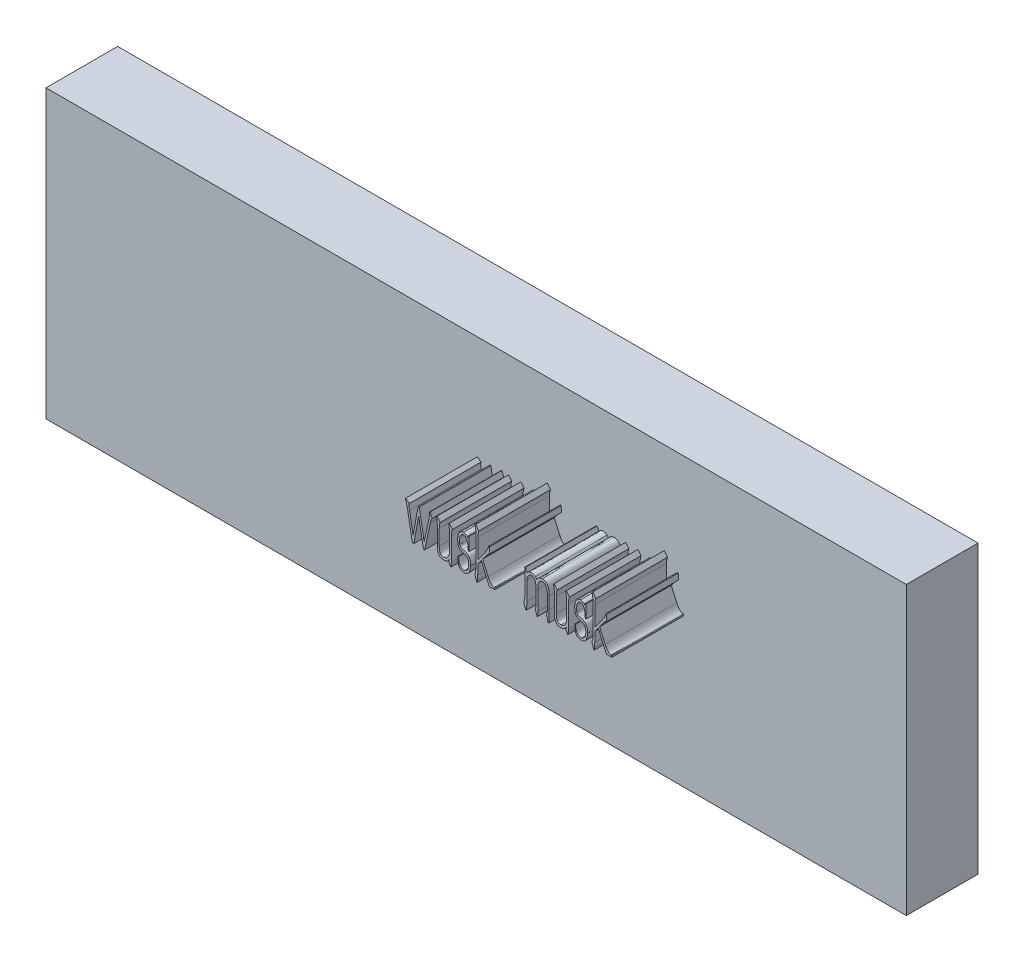
from build123d import *

# Parameters (mm, degrees)
SKETCH_1_W      = 60
SKETCH_1_H      = 20
EXTRUDE_1_DEPTH = 5
EXTRUDE_2_DEPTH = 5


with BuildPart() as part:
    # 草图1 → 凸台-拉伸1 (new body)
    with BuildSketch(Plane.XY):
        Rectangle(SKETCH_1_W, SKETCH_1_H)
    extrude(amount=EXTRUDE_1_DEPTH)

    # 草图2 → 凸台-拉伸2 (add)
    with BuildSketch(Plane.XY.offset(5)):
        with BuildLine():
            Line((0.956850629, 2.693053484), (1.032175581, 2.693053484))
            Line((1.032175581, 2.693053484), (1.374493927, 0.765182186))
            Line((1.374493927, 0.765182186), (1.686234818, 2.215001065))
            add(Edge.make_bspline(
                [(1.686234818, 2.215001065), (1.694034814, 2.25098296), (1.708511764, 2.317766087), (1.723755254, 2.411736454), (1.735575995, 2.491496907), (1.740113853, 2.540393283), (1.742169188, 2.562539953)],
                knots=[0, 0, 0, 0, 1.25398068, 2.327413638, 3.242434274, 4, 4, 4, 4], degree=3))
            Line((1.742169188, 2.562539953), (1.742169188, 2.672917111))
            Line((1.742169188, 2.672917111), (1.746643938, 2.753462604))
            Line((1.746643938, 2.753462604), (1.792137226, 2.778819518))
            Line((1.792137226, 2.778819518), (1.923396548, 2.441721713))
            add(Edge.make_bspline(
                [(1.923396548, 2.441721713), (1.915438067, 2.430541224), (1.900004303, 2.408859068), (1.875735262, 2.374566878), (1.852698706, 2.328662005), (1.833798101, 2.268497129), (1.814819577, 2.20170425), (1.806483591, 2.155909649), (1.802578308, 2.134455572)],
                knots=[0, 0, 0, 0, 0.73960617, 1.434307217, 2.260967932, 3.493612538, 4.825795476, 6, 6, 6, 6], degree=3))
            Line((1.802578308, 2.134455572), (1.414766674, 0.296825059))
            Line((1.414766674, 0.296825059), (1.323780098, 0.296825059))
            Line((1.323780098, 0.296825059), (0.991902834, 2.134455572))
            Line((0.991902834, 2.134455572), (0.654805029, 0.296825059))
            Line((0.654805029, 0.296825059), (0.548902621, 0.296825059))
            Line((0.548902621, 0.296825059), (0.206584274, 2.215001065))
            add(Edge.make_bspline(
                [(0.206584274, 2.215001065), (0.198912438, 2.248321954), (0.184597239, 2.310496781), (0.163982743, 2.39769166), (0.147074131, 2.474104096), (0.127415601, 2.53928743), (0.108679799, 2.59454942), (0.096507892, 2.627939378), (0.090986576, 2.643085446)],
                knots=[0, 0, 0, 0, 1.386558097, 2.587236253, 3.633788418, 4.558844335, 5.346275232, 6, 6, 6, 6], degree=3))
            Line((0.090986576, 2.643085446), (0.065629661, 2.708715108))
            Line((0.065629661, 2.708715108), (0.090986576, 2.763903686))
            Line((0.090986576, 2.763903686), (0.332623056, 2.557319412))
            add(Edge.make_bspline(
                [(0.332623056, 2.557319412), (0.329934305, 2.539424397), (0.325272047, 2.508394672), (0.317905436, 2.463306249), (0.318744441, 2.41459229), (0.318124787, 2.366339195), (0.321879478, 2.317770287), (0.328324646, 2.274328176), (0.336178515, 2.225964508), (0.343632909, 2.192344597), (0.347538888, 2.174728319)],
                knots=[0, 0, 0, 0, 1.125948555, 1.952380253, 2.833667599, 4.147756758, 4.953989267, 5.859088633, 6.878197816, 8, 8, 8, 8], degree=3))
            Line((0.347538888, 2.174728319), (0.6040912, 0.755486895))
            Line((0.6040912, 0.755486895), (0.956850629, 2.693053484))
        make_face()
        with BuildLine():
            Line((3.079373535, 2.718410398), (3.124866823, 2.763903686))
            Line((3.124866823, 2.763903686), (3.341146388, 2.491689751))
            add(Edge.make_bspline(
                [(3.341146388, 2.491689751), (3.335127204, 2.476880592), (3.324424362, 2.450548104), (3.31474904, 2.416817894), (3.308260388, 2.38888809), (3.303313096, 2.360726643), (3.297436787, 2.323631469), (3.287042616, 2.26229054), (3.277646408, 2.177974894), (3.276230477, 2.108877444), (3.275516727, 2.074046452)],
                knots=[0, 0, 0, 0, 0.901954883, 1.603785607, 1.978329198, 2.520694973, 3.217595566, 4.099112837, 6.033621101, 8, 8, 8, 8], degree=3))
            Line((3.275516727, 2.074046452), (3.271041977, 0.493714042))
            Line((3.271041977, 0.493714042), (3.260600895, 0.296825059))
            add(Edge.make_bspline(
                [(3.260600895, 0.296825059), (3.260015138, 0.285378319), (3.258943854, 0.26444349), (3.255309304, 0.236175576), (3.253833678, 0.213986302), (3.250040675, 0.194151459), (3.244934554, 0.17817626), (3.236749598, 0.161933992), (3.223030618, 0.163741996), (3.214049918, 0.174993267), (3.202853577, 0.192573139), (3.195091054, 0.207465128), (3.190496484, 0.216279565)],
                knots=[0, 0, 0, 0, 1.638485852, 2.996610579, 4.068241337, 4.828079896, 5.839672715, 6.62244258, 6.979652832, 7.608485938, 8.584483878, 10, 10, 10, 10], degree=3))
            Line((3.190496484, 0.216279565), (3.11442574, 0.36245472))
            add(Edge.make_bspline(
                [(3.11442574, 0.36245472), (3.109237472, 0.371568592), (3.100128905, 0.387568982), (3.090889622, 0.409378255), (3.083820187, 0.425199719), (3.084377975, 0.434266836), (3.084594076, 0.437779672)],
                knots=[0, 0, 0, 0, 1.529770544, 2.685677999, 3.490797633, 4, 4, 4, 4], degree=3))
            Line((3.084594076, 0.437779672), (3.109950991, 0.48327296))
            Line((3.109950991, 0.48327296), (3.130087364, 0.589175368))
            add(Edge.make_bspline(
                [(3.130087364, 0.589175368), (3.119854153, 0.569911613), (3.100234155, 0.532977479), (3.072949231, 0.488659865), (3.047364841, 0.45513354), (3.019093926, 0.433646228), (2.986817641, 0.409964319), (2.947190812, 0.388763769), (2.901968138, 0.36995589), (2.850348815, 0.356380862), (2.792925865, 0.349534962), (2.752732548, 0.348221699), (2.731834647, 0.347538888)],
                knots=[0, 0, 0, 0, 1.312029654, 2.515536564, 3.132302309, 3.833292519, 4.638429977, 5.542167297, 6.528311998, 7.580541878, 8.742039772, 10, 10, 10, 10], degree=3))
            add(Edge.make_bspline(
                [(2.731834647, 0.347538888), (2.707934865, 0.347387207), (2.662386327, 0.347098133), (2.597539313, 0.35683285), (2.5398564, 0.374410494), (2.489918618, 0.401083366), (2.446817948, 0.434389683), (2.409884203, 0.473872061), (2.378367288, 0.518768429), (2.344936868, 0.586220761), (2.315366494, 0.677701691), (2.301170715, 0.775927949), (2.298391463, 0.862372578), (2.295980876, 0.939931821), (2.294598456, 1.029685469), (2.294243946, 1.093578814), (2.294054975, 1.127636906)],
                knots=[0, 0, 0, 0, 0.968661519, 1.846088638, 2.650099344, 3.403737013, 4.130145597, 4.850928472, 5.589769445, 6.347715959, 7.898125862, 9.468914246, 10.35757796, 11.407170027, 12.617902367, 14, 14, 14, 14], degree=3))
            Line((2.294054975, 1.127636906), (2.294054975, 2.174728319))
            add(Edge.make_bspline(
                [(2.294054975, 2.174728319), (2.2939419, 2.208798516), (2.29372463, 2.274263098), (2.287271989, 2.368528418), (2.27865126, 2.454615867), (2.267422657, 2.53033631), (2.25704408, 2.592127762), (2.251044664, 2.628169047), (2.248561688, 2.643085446)],
                knots=[0, 0, 0, 0, 1.300902488, 2.499634388, 3.606888644, 4.604547608, 5.422464392, 6, 6, 6, 6], degree=3))
            Line((2.248561688, 2.643085446), (2.223950565, 2.718410398))
            Line((2.223950565, 2.718410398), (2.268698061, 2.763903686))
            Line((2.268698061, 2.763903686), (2.490198167, 2.491689751))
            add(Edge.make_bspline(
                [(2.490198167, 2.491689751), (2.484051601, 2.476346533), (2.472759124, 2.448157963), (2.458516081, 2.404686971), (2.447527054, 2.354443766), (2.437925695, 2.303747214), (2.431424871, 2.251652424), (2.427841576, 2.202624281), (2.425677835, 2.14615934), (2.425440336, 2.105869066), (2.425314298, 2.084487535)],
                knots=[0, 0, 0, 0, 0.955062306, 1.754641118, 2.639723451, 3.924612311, 4.735340528, 5.671856169, 6.764483984, 8, 8, 8, 8], degree=3))
            Line((2.425314298, 2.084487535), (2.425314298, 1.026955039))
            add(Edge.make_bspline(
                [(2.425314298, 1.026955039), (2.425487673, 0.993114723), (2.425813361, 0.929545126), (2.434754228, 0.840997868), (2.445183114, 0.764966918), (2.46342138, 0.701977268), (2.485737836, 0.649699395), (2.513309582, 0.607543044), (2.545468208, 0.573925518), (2.582622337, 0.549892534), (2.623819398, 0.533834923), (2.667892564, 0.526692502), (2.714509574, 0.522607318), (2.746020732, 0.526658774), (2.762412103, 0.528766248)],
                knots=[0, 0, 0, 0, 1.7189745, 3.229122124, 4.521318276, 5.613109994, 6.552296241, 7.4004455, 8.159999876, 8.899528822, 9.631679654, 10.390076894, 11.16255546, 12, 12, 12, 12], degree=3))
            add(Edge.make_bspline(
                [(2.762412103, 0.528766248), (2.78816119, 0.532312476), (2.83576389, 0.53886844), (2.899642093, 0.557600142), (2.951569652, 0.580406604), (3.000998795, 0.622014292), (3.045701732, 0.684265281), (3.087916707, 0.763317502), (3.118941538, 0.842713306), (3.133904088, 0.909087919), (3.139397427, 0.96325686), (3.143505782, 1.010718505), (3.144335519, 1.066482619), (3.144769802, 1.106259678), (3.145003196, 1.127636906)],
                knots=[0, 0, 0, 0, 1.171183412, 2.165183308, 2.998184278, 3.707820518, 5.051940327, 6.427255088, 7.748233698, 8.886001551, 9.484403013, 10.204602517, 11.035106635, 12, 12, 12, 12], degree=3))
            Line((3.145003196, 1.127636906), (3.145003196, 2.094182825))
            add(Edge.make_bspline(
                [(3.145003196, 2.094182825), (3.144850716, 2.137695071), (3.144547347, 2.224265433), (3.139150891, 2.33040375), (3.133991537, 2.409660124), (3.130851677, 2.459218735), (3.125975495, 2.498914141), (3.121128073, 2.539807389), (3.113213532, 2.587019898), (3.10423607, 2.62374933), (3.099509908, 2.643085446)],
                knots=[0, 0, 0, 0, 1.89138301, 3.763026071, 4.618502937, 5.344598615, 5.921038749, 6.356690794, 7.134884036, 8, 8, 8, 8], degree=3))
            Line((3.099509908, 2.643085446), (3.079373535, 2.718410398))
        make_face()
        with BuildLine():
            Line((4.42030684, 2.522267206), (4.465800128, 2.66322182))
            Line((4.465800128, 2.66322182), (4.500852333, 2.658001278))
            Line((4.500852333, 2.658001278), (4.500852333, 1.736948647))
            Line((4.500852333, 1.736948647), (4.456104837, 1.736948647))
            add(Edge.make_bspline(
                [(4.456104837, 1.736948647), (4.452625812, 1.78667141), (4.445996573, 1.88141751), (4.436354459, 2.018869804), (4.421625179, 2.149812964), (4.395009218, 2.254181503), (4.368520463, 2.334352191), (4.341804871, 2.387599138), (4.311833094, 2.435317015), (4.275661738, 2.474416059), (4.238118302, 2.506759772), (4.199222339, 2.530385766), (4.159051225, 2.545040791), (4.131800177, 2.546766667), (4.11826124, 2.547624121)],
                knots=[0, 0, 0, 0, 1.88437823, 3.590658997, 5.211116296, 6.856969368, 7.653605172, 8.397603321, 9.104084967, 9.776155038, 10.403139336, 10.972141148, 11.489336478, 12, 12, 12, 12], degree=3))
            add(Edge.make_bspline(
                [(4.11826124, 2.547624121), (4.100646596, 2.546064854), (4.066378892, 2.543031442), (4.019049055, 2.522888982), (3.976681941, 2.494562309), (3.93239471, 2.441415007), (3.889579043, 2.367309418), (3.858948103, 2.269609155), (3.843234994, 2.166710361), (3.834517409, 2.077485446), (3.83148966, 2.003876017), (3.835824724, 1.950568202), (3.842376001, 1.899849842), (3.851843314, 1.868116229), (3.856488387, 1.852546346)],
                knots=[0, 0, 0, 0, 0.763111865, 1.484565427, 2.206018988, 2.955268939, 4.4638776, 5.893852316, 7.371769709, 8.976120531, 9.785810629, 10.56470826, 11.295783766, 12, 12, 12, 12], degree=3))
            add(Edge.make_bspline(
                [(3.856488387, 1.852546346), (3.859766633, 1.838228755), (3.865988508, 1.811054994), (3.881782399, 1.774634166), (3.897387095, 1.742373396), (3.918325534, 1.716030702), (3.943810996, 1.694934312), (3.973561301, 1.676585851), (4.008857992, 1.661860762), (4.03463778, 1.654855964), (4.048156829, 1.651182612)],
                knots=[0, 0, 0, 0, 1.181279318, 2.241983418, 3.192228972, 4.062377461, 4.929751825, 5.847528273, 6.871233056, 8, 8, 8, 8], degree=3))
            Line((4.048156829, 1.651182612), (4.198806733, 1.616130407))
            add(Edge.make_bspline(
                [(4.198806733, 1.616130407), (4.232301465, 1.605241264), (4.2962154, 1.584462833), (4.382284615, 1.537683246), (4.456679096, 1.481057201), (4.504127195, 1.419480231), (4.535552443, 1.364044564), (4.557632442, 1.316604569), (4.575559154, 1.262864891), (4.597980677, 1.183269576), (4.616787913, 1.073775128), (4.617056478, 0.983535306), (4.617195824, 0.936714255)],
                knots=[0, 0, 0, 0, 1.209249621, 2.307464452, 3.354609308, 4.401754164, 4.953353382, 5.546482869, 6.198302843, 6.899633981, 8.39137101, 10, 10, 10, 10], degree=3))
            add(Edge.make_bspline(
                [(4.617195824, 0.936714255), (4.61266176, 0.888061495), (4.60385957, 0.793609617), (4.576723044, 0.68051691), (4.550491712, 0.598297277), (4.529936637, 0.544202137), (4.50678806, 0.497110111), (4.474884718, 0.444372071), (4.428676791, 0.389187156), (4.372369626, 0.347625724), (4.322473492, 0.32277661), (4.279782474, 0.311805808), (4.233497903, 0.302671932), (4.200849959, 0.302259723), (4.183890901, 0.3020456)],
                knots=[0, 0, 0, 0, 2.057181033, 3.993701746, 4.884987729, 5.694367223, 6.430000302, 7.093039265, 8.289669114, 9.435885792, 10.016959139, 10.627150019, 11.286869617, 12, 12, 12, 12], degree=3))
            add(Edge.make_bspline(
                [(4.183890901, 0.3020456), (4.166716962, 0.301584906), (4.132748421, 0.300673695), (4.083075215, 0.307295287), (4.035081084, 0.317317929), (3.977215303, 0.338767014), (3.914594792, 0.372213181), (3.851865097, 0.422031547), (3.808086423, 0.486815326), (3.776396943, 0.56248449), (3.753095282, 0.647578419), (3.73462749, 0.736733625), (3.723230778, 0.825302718), (3.721556397, 0.883485792), (3.720754315, 0.911357341)],
                knots=[0, 0, 0, 0, 0.705919631, 1.396246844, 2.056504843, 2.719925773, 3.928363854, 4.96712199, 5.980428126, 7.107526555, 8.331541373, 9.605625387, 10.853018187, 12, 12, 12, 12], degree=3))
            Line((3.720754315, 0.911357341), (3.715533774, 1.057532495))
            Line((3.715533774, 1.057532495), (3.761027062, 1.057532495))
            add(Edge.make_bspline(
                [(3.761027062, 1.057532495), (3.761560295, 1.033664123), (3.762561496, 0.988848759), (3.767401415, 0.922142153), (3.780462949, 0.852834813), (3.797360407, 0.774480074), (3.827433012, 0.689048051), (3.864179958, 0.618781617), (3.902538495, 0.56673039), (3.937047923, 0.532423684), (3.976308513, 0.502753967), (4.020041475, 0.479590488), (4.065183061, 0.461320882), (4.110875561, 0.452164927), (4.155378814, 0.447057534), (4.184405018, 0.451324291), (4.198806733, 0.453441296)],
                knots=[0, 0, 0, 0, 1.180171397, 2.215895155, 3.300676226, 4.66281128, 6.174567634, 7.763264609, 8.561949105, 9.36129496, 10.159979456, 10.984704713, 11.801612493, 12.555966091, 13.283524481, 14, 14, 14, 14], degree=3))
            add(Edge.make_bspline(
                [(4.198806733, 0.453441296), (4.212571098, 0.455525007), (4.23902737, 0.459530077), (4.276117577, 0.47186835), (4.30956885, 0.487951458), (4.338740899, 0.510710077), (4.365490086, 0.539045119), (4.389679717, 0.574707955), (4.413686148, 0.616811394), (4.436228452, 0.665146799), (4.456472994, 0.718273751), (4.471307473, 0.77475025), (4.480253735, 0.83351122), (4.483392488, 0.892671603), (4.48374868, 0.949143998), (4.483749197, 1.000103485), (4.483508711, 1.043653946), (4.481581406, 1.070216045), (4.48071596, 1.082143618)],
                knots=[0, 0, 0, 0, 0.877851347, 1.68730455, 2.459813735, 3.21046647, 4.01026565, 4.912088624, 5.924932797, 7.069995579, 8.277531082, 9.51162898, 10.750911348, 12.025314486, 13.250286763, 14.318123558, 15.244762084, 16, 16, 16, 16], degree=3))
            add(Edge.make_bspline(
                [(4.48071596, 1.082143618), (4.47378711, 1.112218546), (4.460681063, 1.169105826), (4.430419633, 1.245666982), (4.397216015, 1.310362912), (4.352090855, 1.357723705), (4.301218467, 1.39300016), (4.241442607, 1.419417522), (4.170067771, 1.441995512), (4.087026354, 1.459911254), (4.000805208, 1.482511845), (3.931959894, 1.509072439), (3.883763917, 1.53933113), (3.851513054, 1.568429651), (3.821279352, 1.602949654), (3.794860249, 1.644064819), (3.771665535, 1.690259807), (3.753415312, 1.741245278), (3.738217828, 1.796306022), (3.724082805, 1.874663759), (3.714308334, 1.972866439), (3.712117153, 2.051155995), (3.711059024, 2.088962284)],
                knots=[0, 0, 0, 0, 1.312732654, 2.483057945, 3.5025627, 4.386828712, 5.238919358, 6.125149634, 7.160161885, 8.424087566, 9.742278237, 10.957883032, 11.548460543, 12.15626294, 12.801923705, 13.498163234, 14.232361306, 14.99973133, 15.801420386, 16.663524038, 18.388804572, 20, 20, 20, 20], degree=3))
            add(Edge.make_bspline(
                [(3.711059024, 2.088962284), (3.711355759, 2.110842662), (3.711929664, 2.153160804), (3.71601027, 2.214259605), (3.724650715, 2.27041662), (3.737982362, 2.33919296), (3.764714725, 2.419199492), (3.803604285, 2.509872653), (3.85583499, 2.5910804), (3.913767978, 2.645522379), (3.966929253, 2.678767517), (4.012248998, 2.696051638), (4.061596491, 2.706544999), (4.096082441, 2.707978957), (4.113786491, 2.708715108)],
                knots=[0, 0, 0, 0, 0.958068417, 1.852969566, 2.678027658, 3.444349453, 4.917639168, 6.359843754, 7.757537576, 9.112888036, 9.801703641, 10.490949085, 11.225298654, 12, 12, 12, 12], degree=3))
            add(Edge.make_bspline(
                [(4.113786491, 2.708715108), (4.14273878, 2.705391618), (4.199550832, 2.698870053), (4.274747565, 2.666437031), (4.336035892, 2.629585778), (4.363705153, 2.596745786), (4.375559344, 2.582676326)],
                knots=[0, 0, 0, 0, 1.164144761, 2.284360071, 3.264977708, 4, 4, 4, 4], degree=3))
            Line((4.375559344, 2.582676326), (4.42030684, 2.522267206))
        make_face()
        with BuildLine():
            Line((5.120605157, 1.545280205), (5.644150863, 2.275410185))
            add(Edge.make_bspline(
                [(5.644150863, 2.275410185), (5.659979366, 2.298916394), (5.693192215, 2.348239324), (5.732385734, 2.412426537), (5.761544973, 2.465441369), (5.782526817, 2.50102598), (5.797752347, 2.532990737), (5.814419556, 2.569989981), (5.831347575, 2.616226308), (5.844096192, 2.653504296), (5.850735137, 2.672917111)],
                knots=[0, 0, 0, 0, 1.511957053, 3.172529951, 4.009937113, 4.740410216, 5.375135452, 5.897668644, 6.905193875, 8, 8, 8, 8], degree=3))
            Line((5.850735137, 2.672917111), (5.87534626, 2.748987854))
            Line((5.87534626, 2.748987854), (5.931280631, 2.738546772))
            Line((5.931280631, 2.738546772), (5.940975922, 2.315682932))
            add(Edge.make_bspline(
                [(5.940975922, 2.315682932), (5.928764133, 2.309536186), (5.906611986, 2.298386007), (5.87424806, 2.280874178), (5.841656418, 2.256950723), (5.811595242, 2.23008432), (5.782423786, 2.200187586), (5.756593354, 2.168902301), (5.72563226, 2.13205137), (5.705129311, 2.104017123), (5.6941189, 2.088962284)],
                knots=[0, 0, 0, 0, 0.96646153, 1.753158176, 2.596659124, 3.816416994, 4.599180132, 5.546284665, 6.682315694, 8, 8, 8, 8], degree=3))
            Line((5.6941189, 2.088962284), (5.448007671, 1.75708502))
            Line((5.448007671, 1.75708502), (5.835073514, 0.891220967))
            add(Edge.make_bspline(
                [(5.835073514, 0.891220967), (5.846413565, 0.864956913), (5.867982707, 0.815001839), (5.903816322, 0.746735881), (5.938903125, 0.687773526), (5.984183624, 0.623699368), (6.043748217, 0.559410529), (6.10465073, 0.505036693), (6.153233121, 0.473694998), (6.184075669, 0.455174881), (6.212066582, 0.443485892), (6.229785038, 0.439557088), (6.23780098, 0.437779672)],
                knots=[0, 0, 0, 0, 1.370886093, 2.607469256, 3.692673887, 4.658220336, 6.362432645, 7.883761008, 8.554703716, 9.131156491, 9.606929679, 10, 10, 10, 10], degree=3))
            Line((6.23780098, 0.437779672), (6.2982101, 0.428084381))
            Line((6.2982101, 0.428084381), (6.303430641, 0.332623056))
            Line((6.303430641, 0.332623056), (5.920839548, 0.332623056))
            Line((5.920839548, 0.332623056), (5.357021095, 1.631046239))
            Line((5.357021095, 1.631046239), (5.120605157, 1.308864266))
            Line((5.120605157, 1.308864266), (5.110164074, 0.634668655))
            Line((5.110164074, 0.634668655), (5.100468783, 0.322181973))
            add(Edge.make_bspline(
                [(5.100468783, 0.322181973), (5.100338427, 0.297996517), (5.100106249, 0.254919939), (5.093034428, 0.205682651), (5.085750467, 0.175360061), (5.080617463, 0.162409845), (5.073581035, 0.152620593), (5.068042312, 0.154825275), (5.065416578, 0.155870445)],
                knots=[0, 0, 0, 0, 2.406597193, 4.286376539, 4.978070304, 5.466542587, 5.747104715, 6, 6, 6, 6], degree=3))
            add(Edge.make_bspline(
                [(5.065416578, 0.155870445), (5.063111719, 0.156479495), (5.057011805, 0.158091371), (5.047209479, 0.167481866), (5.036298692, 0.18586932), (5.029370319, 0.201978064), (5.025143831, 0.211804816)],
                knots=[0, 0, 0, 0, 0.397271662, 1.051397412, 2.201276048, 4, 4, 4, 4], degree=3))
            Line((5.025143831, 0.211804816), (5.005007458, 0.276688685))
            Line((5.005007458, 0.276688685), (4.944598338, 0.453441296))
            add(Edge.make_bspline(
                [(4.944598338, 0.453441296), (4.939245299, 0.46930492), (4.929842289, 0.497170555), (4.919117246, 0.534287309), (4.912827653, 0.560802846), (4.909547266, 0.585272811), (4.918936454, 0.612842137), (4.930783605, 0.647217559), (4.945768606, 0.680802366), (4.95781678, 0.714189246), (4.966923798, 0.754590752), (4.972629819, 0.808351386), (4.978269, 0.869773514), (4.981521006, 0.923019706), (4.983801369, 0.969509352), (4.984057089, 1.016019423), (4.985149383, 1.075178663), (4.984969668, 1.118686465), (4.984871085, 1.142552738)],
                knots=[0, 0, 0, 0, 1.142457736, 2.0068119, 2.632308866, 3.006993311, 3.669348092, 4.57068696, 5.506168794, 6.171340735, 6.990057557, 8.323856883, 9.856380766, 11.198994077, 11.963000091, 13.031688272, 14.371727881, 16, 16, 16, 16], degree=3))
            Line((4.984871085, 1.142552738), (4.984871085, 2.990624334))
            add(Edge.make_bspline(
                [(4.984871085, 2.990624334), (4.985033993, 3.013497467), (4.985340374, 3.05651504), (4.983350701, 3.116662151), (4.982245957, 3.168395952), (4.979191731, 3.225367398), (4.974138264, 3.289519827), (4.962196077, 3.361159795), (4.950264589, 3.427150064), (4.942845645, 3.469171147), (4.939377797, 3.488813126)],
                knots=[0, 0, 0, 0, 1.094712718, 2.05882963, 2.880208996, 3.571276556, 4.78969525, 5.957622138, 7.045328208, 8, 8, 8, 8], degree=3))
            Line((4.939377797, 3.488813126), (4.919241423, 3.569358619))
            Line((4.919241423, 3.569358619), (4.964734711, 3.614851907))
            Line((4.964734711, 3.614851907), (5.186234818, 3.322501598))
            add(Edge.make_bspline(
                [(5.186234818, 3.322501598), (5.180103379, 3.305655623), (5.168914397, 3.274914172), (5.1552073, 3.229900909), (5.145306441, 3.184370219), (5.135969396, 3.142291217), (5.130086578, 3.098152891), (5.127641435, 3.051561741), (5.12635766, 2.992373173), (5.126014127, 2.94886122), (5.125825698, 2.924994673)],
                knots=[0, 0, 0, 0, 1.062325433, 1.938589134, 2.785507672, 3.822714499, 4.491512402, 5.421484825, 6.585670171, 8, 8, 8, 8], degree=3))
            Line((5.125825698, 2.924994673), (5.120605157, 1.545280205))
        make_face()
        with BuildLine():
            add(Edge.make_bspline(
                [(9.234391647, 2.416364799), (9.252239678, 2.43874551), (9.286320294, 2.481481227), (9.34045576, 2.539359634), (9.397707997, 2.588477031), (9.463392945, 2.624442965), (9.536886033, 2.65040827), (9.589657371, 2.655410888), (9.61698274, 2.658001278)],
                knots=[0, 0, 0, 0, 1.097159194, 2.095013154, 3.035933001, 3.974677868, 4.951273982, 6, 6, 6, 6], degree=3))
            add(Edge.make_bspline(
                [(9.61698274, 2.658001278), (9.646190311, 2.657067172), (9.703064386, 2.655248244), (9.771865653, 2.638117875), (9.82381142, 2.618414994), (9.861105793, 2.597474706), (9.896470538, 2.570060946), (9.940889995, 2.526221022), (9.989855053, 2.461536156), (10.023290186, 2.385751579), (10.043778195, 2.319638156), (10.057143304, 2.264317228), (10.068045623, 2.203743794), (10.080832532, 2.116619115), (10.092480509, 2.003987558), (10.094183282, 1.912988075), (10.095035159, 1.867462178)],
                knots=[0, 0, 0, 0, 1.166996922, 2.272420106, 2.817555006, 3.387814551, 3.976949789, 4.603236808, 5.882949516, 7.196532102, 7.895238063, 8.653091083, 9.472834461, 10.3580348, 12.177970592, 14, 14, 14, 14], degree=3))
            Line((10.095035159, 1.867462178), (10.095035159, 1.012039207))
            add(Edge.make_bspline(
                [(10.095035159, 1.012039207), (10.095152747, 0.983698163), (10.095401349, 0.923780285), (10.093301616, 0.829074492), (10.092171056, 0.724654824), (10.089982943, 0.615772853), (10.087224943, 0.512369912), (10.087231028, 0.424353465), (10.085596391, 0.356487479), (10.086841819, 0.306519352), (10.087268756, 0.270203939), (10.085614397, 0.243058642), (10.080836326, 0.222941743), (10.071698324, 0.206639943), (10.059276909, 0.197800554), (10.043316198, 0.191064255), (10.031735659, 0.206072569), (10.024024281, 0.222372493), (10.017323958, 0.246739571), (10.008131125, 0.276033959), (9.997187668, 0.31601176), (9.988668856, 0.345814032), (9.98391221, 0.36245472)],
                knots=[0, 0, 0, 0, 1.668545598, 3.527594419, 5.576894584, 7.816688853, 9.939415945, 11.66656902, 12.998558643, 13.935400335, 14.60867312, 15.137408637, 15.531504822, 15.820179061, 16.206590182, 16.447979296, 16.706923024, 17.16511372, 17.563265891, 18.174498434, 18.980695134, 20, 20, 20, 20], degree=3))
            Line((9.98391221, 0.36245472), (9.933944172, 0.523545706))
            add(Edge.make_bspline(
                [(9.933944172, 0.523545706), (9.930409206, 0.53372277), (9.923982576, 0.552224851), (9.916057957, 0.57734447), (9.912337225, 0.597798956), (9.913370523, 0.609556615), (9.913807799, 0.614532282)],
                knots=[0, 0, 0, 0, 1.374458822, 2.49879042, 3.364710346, 4, 4, 4, 4], degree=3))
            Line((9.913807799, 0.614532282), (9.933944172, 0.654805029))
            add(Edge.make_bspline(
                [(9.933944172, 0.654805029), (9.934158417, 0.657543577), (9.934726621, 0.664806542), (9.937240608, 0.678763852), (9.94193434, 0.698247224), (9.947108148, 0.72436393), (9.9535529, 0.75701239), (9.957344958, 0.797211517), (9.96123852, 0.844435687), (9.962890035, 0.878285781), (9.963775836, 0.896441509)],
                knots=[0, 0, 0, 0, 0.270200862, 0.716605739, 1.393214368, 2.242395503, 3.336406814, 4.665529256, 6.211534079, 8, 8, 8, 8], degree=3))
            Line((9.963775836, 0.896441509), (9.968996378, 1.842851055))
            add(Edge.make_bspline(
                [(9.968996378, 1.842851055), (9.968801603, 1.852796523), (9.968348419, 1.875936707), (9.966062075, 1.915752789), (9.961074467, 1.965141129), (9.955012284, 2.04143481), (9.943046857, 2.135201282), (9.927481665, 2.22477937), (9.907402741, 2.289393252), (9.884000572, 2.3343204), (9.851819348, 2.376867294), (9.814089929, 2.417597856), (9.769428673, 2.452200024), (9.717661967, 2.475360274), (9.660618758, 2.486048481), (9.621479189, 2.483372613), (9.601321117, 2.48199446)],
                knots=[0, 0, 0, 0, 0.497531525, 1.157609791, 1.994048707, 2.980215242, 4.98520248, 6.721483315, 7.519710007, 8.359469601, 9.239856946, 10.181018871, 11.131010515, 12.043817659, 12.992506382, 14, 14, 14, 14], degree=3))
            add(Edge.make_bspline(
                [(9.601321117, 2.48199446), (9.584497103, 2.479130356), (9.551560791, 2.473523311), (9.506032478, 2.454885066), (9.46444882, 2.431233067), (9.419215079, 2.388980191), (9.372569239, 2.330160732), (9.339497069, 2.270231624), (9.326562864, 2.22374374), (9.321092412, 2.192002204), (9.315859287, 2.152699365), (9.311342436, 2.105697243), (9.308763896, 2.050696035), (9.306489112, 1.988046712), (9.305042471, 1.917933345), (9.304684216, 1.868705758), (9.304496058, 1.842851055)],
                knots=[0, 0, 0, 0, 0.915149417, 1.791584769, 2.630823118, 3.473568715, 5.100176098, 6.660825913, 7.105271245, 7.690054186, 8.391574603, 9.237707285, 10.228544875, 11.352355912, 12.609437143, 14, 14, 14, 14], degree=3))
            Line((9.304496058, 1.842851055), (9.304496058, 0.523545706))
            add(Edge.make_bspline(
                [(9.304496058, 0.523545706), (9.304568585, 0.5049004), (9.304706877, 0.469348189), (9.303784744, 0.419134181), (9.303, 0.374635411), (9.30249735, 0.33634112), (9.301103955, 0.303741224), (9.298756282, 0.277180488), (9.296689892, 0.256215746), (9.293886438, 0.237667047), (9.290578711, 0.220635257), (9.285718473, 0.208793097), (9.280973959, 0.198257046), (9.276534667, 0.200442853), (9.274664394, 0.201363733)],
                knots=[0, 0, 0, 0, 2.018694608, 3.84917562, 5.437443463, 6.837330508, 7.995966644, 8.968298726, 9.726258143, 10.270599101, 11.015056889, 11.534889805, 11.804049086, 12, 12, 12, 12], degree=3))
            add(Edge.make_bspline(
                [(9.274664394, 0.201363733), (9.272389634, 0.202021996), (9.265792167, 0.20393115), (9.255769258, 0.21123101), (9.245425515, 0.222949761), (9.23875018, 0.236883632), (9.235830135, 0.252270045), (9.229896681, 0.2689853), (9.222621562, 0.291075462), (9.217229445, 0.307759106), (9.214255274, 0.316961432)],
                knots=[0, 0, 0, 0, 0.416697809, 1.208545478, 2.142378398, 3.16402006, 3.888430023, 4.902489823, 6.29148252, 8, 8, 8, 8], degree=3))
            Line((9.214255274, 0.316961432), (9.153846154, 0.488493501))
            add(Edge.make_bspline(
                [(9.153846154, 0.488493501), (9.148106429, 0.504384458), (9.138096436, 0.532098047), (9.125398253, 0.568200749), (9.119049015, 0.593264691), (9.116662005, 0.613883722), (9.125950797, 0.632082918), (9.133458141, 0.656668138), (9.145698119, 0.687439184), (9.155556888, 0.720017574), (9.162018511, 0.754340262), (9.166560656, 0.789162708), (9.168351861, 0.832286506), (9.168616919, 0.863627102), (9.168761986, 0.880779885)],
                knots=[0, 0, 0, 0, 1.502686716, 2.620662923, 3.3924411, 3.812845123, 4.420784842, 5.147603737, 6.112263195, 7.356718112, 8.167070135, 9.214007623, 10.475219694, 12, 12, 12, 12], degree=3))
            Line((9.168761986, 0.880779885), (9.173982527, 1.842851055))
            add(Edge.make_bspline(
                [(9.173982527, 1.842851055), (9.17374433, 1.853540389), (9.173206877, 1.877659111), (9.172042855, 1.917988303), (9.167603133, 1.966642977), (9.163639631, 2.021618997), (9.158776044, 2.0778464), (9.152909875, 2.130081906), (9.146206407, 2.17586658), (9.136596292, 2.228389268), (9.119391583, 2.289473349), (9.081730209, 2.35405143), (9.033379679, 2.412667502), (8.969570364, 2.449273285), (8.909083499, 2.475297858), (8.86913283, 2.479968248), (8.851800554, 2.48199446)],
                knots=[0, 0, 0, 0, 0.564606381, 1.273941307, 2.129706037, 3.143536047, 4.184618774, 5.109478364, 5.918883535, 6.626881124, 7.930739658, 9.241452327, 10.552887859, 11.885891606, 13.082811067, 14, 14, 14, 14], degree=3))
            add(Edge.make_bspline(
                [(8.851800554, 2.48199446), (8.843537297, 2.480484302), (8.825898442, 2.477260699), (8.798102146, 2.46674022), (8.767610711, 2.451122069), (8.724046409, 2.424882851), (8.673725162, 2.387760572), (8.622195999, 2.334973967), (8.585403105, 2.268838538), (8.559630783, 2.192194221), (8.543655507, 2.110221341), (8.540717928, 2.054964115), (8.539313872, 2.028553164)],
                knots=[0, 0, 0, 0, 0.421476153, 0.899688394, 1.486375, 2.142042782, 3.453913914, 4.620616388, 5.81854381, 7.221271278, 8.671868436, 10, 10, 10, 10], degree=3))
            Line((8.539313872, 2.028553164), (8.53409333, 0.755486895))
            add(Edge.make_bspline(
                [(8.53409333, 0.755486895), (8.534260432, 0.72863648), (8.534573005, 0.67841097), (8.5325605, 0.608318151), (8.531514318, 0.548632472), (8.52836559, 0.484485166), (8.524323915, 0.415093525), (8.517481835, 0.341966069), (8.511581343, 0.282835763), (8.507246176, 0.239178239), (8.503784869, 0.212388414), (8.499900852, 0.193360016), (8.485252277, 0.189339232), (8.477961934, 0.193627174), (8.473684211, 0.196143192)],
                knots=[0, 0, 0, 0, 1.64190357, 3.071291216, 4.287896094, 5.292317629, 6.998354817, 8.539922834, 9.777341985, 10.648689864, 11.186190396, 11.49960437, 11.706384953, 12, 12, 12, 12], degree=3))
            add(Edge.make_bspline(
                [(8.473684211, 0.196143192), (8.467351876, 0.199303748), (8.453593325, 0.206170833), (8.444303194, 0.233589282), (8.434544631, 0.270323365), (8.424487207, 0.299550034), (8.418495632, 0.316961432)],
                knots=[0, 0, 0, 0, 0.599074229, 1.301635721, 2.392485552, 4, 4, 4, 4], degree=3))
            Line((8.418495632, 0.316961432), (8.358086512, 0.488493501))
            add(Edge.make_bspline(
                [(8.358086512, 0.488493501), (8.35297789, 0.503612471), (8.343813824, 0.530733532), (8.333523437, 0.566885913), (8.326886425, 0.593350199), (8.323827084, 0.618324823), (8.332949605, 0.646929653), (8.344923343, 0.682068974), (8.359915622, 0.715876907), (8.369987902, 0.7429414), (8.375303534, 0.765528378), (8.378636961, 0.789244306), (8.382449035, 0.82106317), (8.386869412, 0.871318569), (8.391485159, 0.931802403), (8.397709585, 0.989113812), (8.401043588, 1.033631468), (8.40207306, 1.073940845), (8.404073864, 1.123146361), (8.403753366, 1.15895725), (8.4035798, 1.178350735)],
                knots=[0, 0, 0, 0, 1.224001232, 2.195666149, 2.880219036, 3.320413069, 4.102156795, 5.133358169, 6.184981354, 6.932735303, 7.34433354, 7.961878087, 8.768343447, 9.802361354, 11.830726809, 13.420615288, 14.223466219, 15.253785847, 16.512780229, 18, 18, 18, 18], degree=3))
            Line((8.4035798, 1.178350735), (8.408800341, 2.229916898))
            add(Edge.make_bspline(
                [(8.408800341, 2.229916898), (8.408966176, 2.259998891), (8.409277313, 2.316438396), (8.407266126, 2.395232916), (8.406227762, 2.46262417), (8.404407459, 2.503624896), (8.4035798, 2.522267206)],
                knots=[0, 0, 0, 0, 1.234375642, 2.315921974, 3.234279288, 4, 4, 4, 4], degree=3))
            Line((8.4035798, 2.522267206), (8.393138717, 2.637864905))
            Line((8.393138717, 2.637864905), (8.383443426, 2.738546772))
            Line((8.383443426, 2.738546772), (8.428936714, 2.748987854))
            Line((8.428936714, 2.748987854), (8.559450245, 2.491689751))
            add(Edge.make_bspline(
                [(8.559450245, 2.491689751), (8.574095851, 2.50613437), (8.602390323, 2.534040547), (8.644143349, 2.57444544), (8.687638926, 2.610708982), (8.738385111, 2.636694954), (8.795163759, 2.654031759), (8.859506991, 2.656705336), (8.931488377, 2.648026335), (8.995018039, 2.629917556), (9.047016929, 2.611724481), (9.081696756, 2.593748535), (9.110937577, 2.572828629), (9.126266528, 2.55586239), (9.133709781, 2.547624121)],
                knots=[0, 0, 0, 0, 1.128901386, 2.180972772, 3.19106158, 4.222490723, 5.288974718, 6.423551697, 7.728474675, 9.254322165, 10.040057965, 10.748014846, 11.392075655, 12, 12, 12, 12], degree=3))
            Line((9.133709781, 2.547624121), (9.234391647, 2.416364799))
        make_face()
        with BuildLine():
            Line((11.241316855, 2.718410398), (11.286810143, 2.763903686))
            Line((11.286810143, 2.763903686), (11.503089708, 2.491689751))
            add(Edge.make_bspline(
                [(11.503089708, 2.491689751), (11.497070524, 2.476880592), (11.486367682, 2.450548104), (11.47669236, 2.416817894), (11.470203707, 2.38888809), (11.465256416, 2.360726643), (11.459380107, 2.323631469), (11.448985936, 2.26229054), (11.439589728, 2.177974894), (11.438173797, 2.108877444), (11.437460047, 2.074046452)],
                knots=[0, 0, 0, 0, 0.901954883, 1.603785607, 1.978329198, 2.520694973, 3.217595566, 4.099112837, 6.033621101, 8, 8, 8, 8], degree=3))
            Line((11.437460047, 2.074046452), (11.432985297, 0.493714042))
            Line((11.432985297, 0.493714042), (11.422544215, 0.296825059))
            add(Edge.make_bspline(
                [(11.422544215, 0.296825059), (11.421958458, 0.285378319), (11.420887174, 0.26444349), (11.417252624, 0.236175576), (11.415776998, 0.213986302), (11.411983994, 0.194151459), (11.406877874, 0.17817626), (11.398692918, 0.161933992), (11.384973937, 0.163741996), (11.375993237, 0.174993267), (11.364796897, 0.192573139), (11.357034373, 0.207465128), (11.352439804, 0.216279565)],
                knots=[0, 0, 0, 0, 1.638485852, 2.996610579, 4.068241337, 4.828079896, 5.839672715, 6.62244258, 6.979652832, 7.608485938, 8.584483878, 10, 10, 10, 10], degree=3))
            Line((11.352439804, 0.216279565), (11.27636906, 0.36245472))
            add(Edge.make_bspline(
                [(11.27636906, 0.36245472), (11.271180792, 0.371568592), (11.262072225, 0.387568982), (11.252832942, 0.409378255), (11.245763506, 0.425199719), (11.246321295, 0.434266836), (11.246537396, 0.437779672)],
                knots=[0, 0, 0, 0, 1.529770544, 2.685677999, 3.490797633, 4, 4, 4, 4], degree=3))
            Line((11.246537396, 0.437779672), (11.271894311, 0.48327296))
            Line((11.271894311, 0.48327296), (11.292030684, 0.589175368))
            add(Edge.make_bspline(
                [(11.292030684, 0.589175368), (11.281797472, 0.569911613), (11.262177475, 0.532977479), (11.234892551, 0.488659865), (11.209308161, 0.45513354), (11.181037245, 0.433646228), (11.148760961, 0.409964319), (11.109134132, 0.388763769), (11.063911458, 0.36995589), (11.012292135, 0.356380862), (10.954869185, 0.349534962), (10.914675867, 0.348221699), (10.893777967, 0.347538888)],
                knots=[0, 0, 0, 0, 1.312029654, 2.515536564, 3.132302309, 3.833292519, 4.638429977, 5.542167297, 6.528311998, 7.580541878, 8.742039772, 10, 10, 10, 10], degree=3))
            add(Edge.make_bspline(
                [(10.893777967, 0.347538888), (10.869878185, 0.347387207), (10.824329647, 0.347098133), (10.759482633, 0.35683285), (10.70179972, 0.374410494), (10.651861938, 0.401083366), (10.608761268, 0.434389683), (10.571827523, 0.473872061), (10.540310608, 0.518768429), (10.506880188, 0.586220761), (10.477309814, 0.677701691), (10.463114035, 0.775927949), (10.460334783, 0.862372578), (10.457924196, 0.939931821), (10.456541776, 1.029685469), (10.456187266, 1.093578814), (10.455998295, 1.127636906)],
                knots=[0, 0, 0, 0, 0.968661519, 1.846088638, 2.650099344, 3.403737013, 4.130145597, 4.850928472, 5.589769445, 6.347715959, 7.898125862, 9.468914246, 10.35757796, 11.407170027, 12.617902367, 14, 14, 14, 14], degree=3))
            Line((10.455998295, 1.127636906), (10.455998295, 2.174728319))
            add(Edge.make_bspline(
                [(10.455998295, 2.174728319), (10.45588522, 2.208798516), (10.45566795, 2.274263098), (10.449215308, 2.368528418), (10.440594579, 2.454615867), (10.429365976, 2.53033631), (10.418987399, 2.592127762), (10.412987984, 2.628169047), (10.410505007, 2.643085446)],
                knots=[0, 0, 0, 0, 1.300902488, 2.499634388, 3.606888644, 4.604547608, 5.422464392, 6, 6, 6, 6], degree=3))
            Line((10.410505007, 2.643085446), (10.385893885, 2.718410398))
            Line((10.385893885, 2.718410398), (10.430641381, 2.763903686))
            Line((10.430641381, 2.763903686), (10.652141487, 2.491689751))
            add(Edge.make_bspline(
                [(10.652141487, 2.491689751), (10.645994921, 2.476346533), (10.634702444, 2.448157963), (10.620459401, 2.404686971), (10.609470374, 2.354443766), (10.599869015, 2.303747214), (10.593368191, 2.251652424), (10.589784896, 2.202624281), (10.587621155, 2.14615934), (10.587383656, 2.105869066), (10.587257618, 2.084487535)],
                knots=[0, 0, 0, 0, 0.955062306, 1.754641118, 2.639723451, 3.924612311, 4.735340528, 5.671856169, 6.764483984, 8, 8, 8, 8], degree=3))
            Line((10.587257618, 2.084487535), (10.587257618, 1.026955039))
            add(Edge.make_bspline(
                [(10.587257618, 1.026955039), (10.587430993, 0.993114723), (10.587756681, 0.929545126), (10.596697547, 0.840997868), (10.607126434, 0.764966918), (10.6253647, 0.701977268), (10.647681155, 0.649699395), (10.675252902, 0.607543044), (10.707411527, 0.573925518), (10.744565657, 0.549892534), (10.785762718, 0.533834923), (10.829835884, 0.526692502), (10.876452894, 0.522607318), (10.907964052, 0.526658774), (10.924355423, 0.528766248)],
                knots=[0, 0, 0, 0, 1.7189745, 3.229122124, 4.521318276, 5.613109994, 6.552296241, 7.4004455, 8.159999876, 8.899528822, 9.631679654, 10.390076894, 11.16255546, 12, 12, 12, 12], degree=3))
            add(Edge.make_bspline(
                [(10.924355423, 0.528766248), (10.95010451, 0.532312476), (10.99770721, 0.53886844), (11.061585413, 0.557600142), (11.113512972, 0.580406604), (11.162942115, 0.622014292), (11.207645052, 0.684265281), (11.249860026, 0.763317502), (11.280884858, 0.842713306), (11.295847408, 0.909087919), (11.301340747, 0.96325686), (11.305449102, 1.010718505), (11.306278839, 1.066482619), (11.306713121, 1.106259678), (11.306946516, 1.127636906)],
                knots=[0, 0, 0, 0, 1.171183412, 2.165183308, 2.998184278, 3.707820518, 5.051940327, 6.427255088, 7.748233698, 8.886001551, 9.484403013, 10.204602517, 11.035106635, 12, 12, 12, 12], degree=3))
            Line((11.306946516, 1.127636906), (11.306946516, 2.094182825))
            add(Edge.make_bspline(
                [(11.306946516, 2.094182825), (11.306794036, 2.137695071), (11.306490667, 2.224265433), (11.301094211, 2.33040375), (11.295934856, 2.409660124), (11.292794997, 2.459218735), (11.287918814, 2.498914141), (11.283071393, 2.539807389), (11.275156852, 2.587019898), (11.26617939, 2.62374933), (11.261453228, 2.643085446)],
                knots=[0, 0, 0, 0, 1.89138301, 3.763026071, 4.618502937, 5.344598615, 5.921038749, 6.356690794, 7.134884036, 8, 8, 8, 8], degree=3))
            Line((11.261453228, 2.643085446), (11.241316855, 2.718410398))
        make_face()
        with BuildLine():
            Line((12.58225016, 2.522267206), (12.627743448, 2.66322182))
            Line((12.627743448, 2.66322182), (12.662795653, 2.658001278))
            Line((12.662795653, 2.658001278), (12.662795653, 1.736948647))
            Line((12.662795653, 1.736948647), (12.618048157, 1.736948647))
            add(Edge.make_bspline(
                [(12.618048157, 1.736948647), (12.614569131, 1.78667141), (12.607939892, 1.88141751), (12.598297779, 2.018869804), (12.583568499, 2.149812964), (12.556952538, 2.254181503), (12.530463782, 2.334352191), (12.503748191, 2.387599138), (12.473776414, 2.435317015), (12.437605058, 2.474416059), (12.400061622, 2.506759772), (12.361165659, 2.530385766), (12.320994545, 2.545040791), (12.293743497, 2.546766667), (12.28020456, 2.547624121)],
                knots=[0, 0, 0, 0, 1.88437823, 3.590658997, 5.211116296, 6.856969368, 7.653605172, 8.397603321, 9.104084967, 9.776155038, 10.403139336, 10.972141148, 11.489336478, 12, 12, 12, 12], degree=3))
            add(Edge.make_bspline(
                [(12.28020456, 2.547624121), (12.262589916, 2.546064854), (12.228322212, 2.543031442), (12.180992374, 2.522888982), (12.138625261, 2.494562309), (12.09433803, 2.441415007), (12.051522363, 2.367309418), (12.020891422, 2.269609155), (12.005178314, 2.166710361), (11.996460729, 2.077485446), (11.99343298, 2.003876017), (11.997768044, 1.950568202), (12.00431932, 1.899849842), (12.013786633, 1.868116229), (12.018431707, 1.852546346)],
                knots=[0, 0, 0, 0, 0.763111865, 1.484565427, 2.206018988, 2.955268939, 4.4638776, 5.893852316, 7.371769709, 8.976120531, 9.785810629, 10.56470826, 11.295783766, 12, 12, 12, 12], degree=3))
            add(Edge.make_bspline(
                [(12.018431707, 1.852546346), (12.021709952, 1.838228755), (12.027931828, 1.811054994), (12.043725719, 1.774634166), (12.059330415, 1.742373396), (12.080268854, 1.716030702), (12.105754316, 1.694934312), (12.13550462, 1.676585851), (12.170801312, 1.661860762), (12.196581099, 1.654855964), (12.210100149, 1.651182612)],
                knots=[0, 0, 0, 0, 1.181279318, 2.241983418, 3.192228972, 4.062377461, 4.929751825, 5.847528273, 6.871233056, 8, 8, 8, 8], degree=3))
            Line((12.210100149, 1.651182612), (12.360750053, 1.616130407))
            add(Edge.make_bspline(
                [(12.360750053, 1.616130407), (12.394244784, 1.605241264), (12.458158719, 1.584462833), (12.544227935, 1.537683246), (12.618622416, 1.481057201), (12.666070515, 1.419480231), (12.697495763, 1.364044564), (12.719575762, 1.316604569), (12.737502474, 1.262864891), (12.759923997, 1.183269576), (12.778731233, 1.073775128), (12.778999798, 0.983535306), (12.779139143, 0.936714255)],
                knots=[0, 0, 0, 0, 1.209249621, 2.307464452, 3.354609308, 4.401754164, 4.953353382, 5.546482869, 6.198302843, 6.899633981, 8.39137101, 10, 10, 10, 10], degree=3))
            add(Edge.make_bspline(
                [(12.779139143, 0.936714255), (12.77460508, 0.888061495), (12.76580289, 0.793609617), (12.738666364, 0.68051691), (12.712435032, 0.598297277), (12.691879956, 0.544202137), (12.66873138, 0.497110111), (12.636828037, 0.444372071), (12.590620111, 0.389187156), (12.534312946, 0.347625724), (12.484416812, 0.32277661), (12.441725794, 0.311805808), (12.395441223, 0.302671932), (12.362793278, 0.302259723), (12.345834221, 0.3020456)],
                knots=[0, 0, 0, 0, 2.057181033, 3.993701746, 4.884987729, 5.694367223, 6.430000302, 7.093039265, 8.289669114, 9.435885792, 10.016959139, 10.627150019, 11.286869617, 12, 12, 12, 12], degree=3))
            add(Edge.make_bspline(
                [(12.345834221, 0.3020456), (12.328660281, 0.301584906), (12.294691741, 0.300673695), (12.245018535, 0.307295287), (12.197024404, 0.317317929), (12.139158623, 0.338767014), (12.076538112, 0.372213181), (12.013808417, 0.422031547), (11.970029743, 0.486815326), (11.938340263, 0.56248449), (11.915038602, 0.647578419), (11.89657081, 0.736733625), (11.885174098, 0.825302718), (11.883499717, 0.883485792), (11.882697635, 0.911357341)],
                knots=[0, 0, 0, 0, 0.705919631, 1.396246844, 2.056504843, 2.719925773, 3.928363854, 4.96712199, 5.980428126, 7.107526555, 8.331541373, 9.605625387, 10.853018187, 12, 12, 12, 12], degree=3))
            Line((11.882697635, 0.911357341), (11.877477094, 1.057532495))
            Line((11.877477094, 1.057532495), (11.922970381, 1.057532495))
            add(Edge.make_bspline(
                [(11.922970381, 1.057532495), (11.923503615, 1.033664123), (11.924504816, 0.988848759), (11.929344735, 0.922142153), (11.942406269, 0.852834813), (11.959303727, 0.774480074), (11.989376332, 0.689048051), (12.026123278, 0.618781617), (12.064481815, 0.56673039), (12.098991243, 0.532423684), (12.138251833, 0.502753967), (12.181984795, 0.479590488), (12.227126381, 0.461320882), (12.272818881, 0.452164927), (12.317322133, 0.447057534), (12.346348338, 0.451324291), (12.360750053, 0.453441296)],
                knots=[0, 0, 0, 0, 1.180171397, 2.215895155, 3.300676226, 4.66281128, 6.174567634, 7.763264609, 8.561949105, 9.36129496, 10.159979456, 10.984704713, 11.801612493, 12.555966091, 13.283524481, 14, 14, 14, 14], degree=3))
            add(Edge.make_bspline(
                [(12.360750053, 0.453441296), (12.374514417, 0.455525007), (12.40097069, 0.459530077), (12.438060897, 0.47186835), (12.47151217, 0.487951458), (12.500684219, 0.510710077), (12.527433406, 0.539045119), (12.551623037, 0.574707955), (12.575629468, 0.616811394), (12.598171772, 0.665146799), (12.618416314, 0.718273751), (12.633250793, 0.77475025), (12.642197055, 0.83351122), (12.645335807, 0.892671603), (12.645692, 0.949143998), (12.645692517, 1.000103485), (12.645452031, 1.043653946), (12.643524726, 1.070216045), (12.64265928, 1.082143618)],
                knots=[0, 0, 0, 0, 0.877851347, 1.68730455, 2.459813735, 3.21046647, 4.01026565, 4.912088624, 5.924932797, 7.069995579, 8.277531082, 9.51162898, 10.750911348, 12.025314486, 13.250286763, 14.318123558, 15.244762084, 16, 16, 16, 16], degree=3))
            add(Edge.make_bspline(
                [(12.64265928, 1.082143618), (12.63573043, 1.112218546), (12.622624383, 1.169105826), (12.592362953, 1.245666982), (12.559159335, 1.310362912), (12.514034175, 1.357723705), (12.463161787, 1.39300016), (12.403385927, 1.419417522), (12.33201109, 1.441995512), (12.248969673, 1.459911254), (12.162748528, 1.482511845), (12.093903213, 1.509072439), (12.045707237, 1.53933113), (12.013456374, 1.568429651), (11.983222672, 1.602949654), (11.956803569, 1.644064819), (11.933608855, 1.690259807), (11.915358632, 1.741245278), (11.900161147, 1.796306022), (11.886026125, 1.874663759), (11.876251654, 1.972866439), (11.874060473, 2.051155995), (11.873002344, 2.088962284)],
                knots=[0, 0, 0, 0, 1.312732654, 2.483057945, 3.5025627, 4.386828712, 5.238919358, 6.125149634, 7.160161885, 8.424087566, 9.742278237, 10.957883032, 11.548460543, 12.15626294, 12.801923705, 13.498163234, 14.232361306, 14.99973133, 15.801420386, 16.663524038, 18.388804572, 20, 20, 20, 20], degree=3))
            add(Edge.make_bspline(
                [(11.873002344, 2.088962284), (11.873299079, 2.110842662), (11.873872984, 2.153160804), (11.87795359, 2.214259605), (11.886594035, 2.27041662), (11.899925682, 2.33919296), (11.926658045, 2.419199492), (11.965547604, 2.509872653), (12.01777831, 2.5910804), (12.075711298, 2.645522379), (12.128872573, 2.678767517), (12.174192318, 2.696051638), (12.223539811, 2.706544999), (12.258025761, 2.707978957), (12.27572981, 2.708715108)],
                knots=[0, 0, 0, 0, 0.958068417, 1.852969566, 2.678027658, 3.444349453, 4.917639168, 6.359843754, 7.757537576, 9.112888036, 9.801703641, 10.490949085, 11.225298654, 12, 12, 12, 12], degree=3))
            add(Edge.make_bspline(
                [(12.27572981, 2.708715108), (12.3046821, 2.705391618), (12.361494152, 2.698870053), (12.436690885, 2.666437031), (12.497979212, 2.629585778), (12.525648473, 2.596745786), (12.537502664, 2.582676326)],
                knots=[0, 0, 0, 0, 1.164144761, 2.284360071, 3.264977708, 4, 4, 4, 4], degree=3))
            Line((12.537502664, 2.582676326), (12.58225016, 2.522267206))
        make_face()
        with BuildLine():
            Line((13.282548476, 1.545280205), (13.806094183, 2.275410185))
            add(Edge.make_bspline(
                [(13.806094183, 2.275410185), (13.821922686, 2.298916394), (13.855135534, 2.348239324), (13.894329054, 2.412426537), (13.923488293, 2.465441369), (13.944470137, 2.50102598), (13.959695667, 2.532990737), (13.976362876, 2.569989981), (13.993290895, 2.616226308), (14.006039512, 2.653504296), (14.012678457, 2.672917111)],
                knots=[0, 0, 0, 0, 1.511957053, 3.172529951, 4.009937113, 4.740410216, 5.375135452, 5.897668644, 6.905193875, 8, 8, 8, 8], degree=3))
            Line((14.012678457, 2.672917111), (14.03728958, 2.748987854))
            Line((14.03728958, 2.748987854), (14.093223951, 2.738546772))
            Line((14.093223951, 2.738546772), (14.102919241, 2.315682932))
            add(Edge.make_bspline(
                [(14.102919241, 2.315682932), (14.090707453, 2.309536186), (14.068555306, 2.298386007), (14.03619138, 2.280874178), (14.003599738, 2.256950723), (13.973538562, 2.23008432), (13.944367106, 2.200187586), (13.918536674, 2.168902301), (13.88757558, 2.13205137), (13.867072631, 2.104017123), (13.85606222, 2.088962284)],
                knots=[0, 0, 0, 0, 0.96646153, 1.753158176, 2.596659124, 3.816416994, 4.599180132, 5.546284665, 6.682315694, 8, 8, 8, 8], degree=3))
            Line((13.85606222, 2.088962284), (13.609950991, 1.75708502))
            Line((13.609950991, 1.75708502), (13.997016834, 0.891220967))
            add(Edge.make_bspline(
                [(13.997016834, 0.891220967), (14.008356885, 0.864956913), (14.029926027, 0.815001839), (14.065759642, 0.746735881), (14.100846444, 0.687773526), (14.146126944, 0.623699368), (14.205691537, 0.559410529), (14.26659405, 0.505036693), (14.315176441, 0.473694998), (14.346018989, 0.455174881), (14.374009902, 0.443485892), (14.391728358, 0.439557088), (14.3997443, 0.437779672)],
                knots=[0, 0, 0, 0, 1.370886093, 2.607469256, 3.692673887, 4.658220336, 6.362432645, 7.883761008, 8.554703716, 9.131156491, 9.606929679, 10, 10, 10, 10], degree=3))
            Line((14.3997443, 0.437779672), (14.46015342, 0.428084381))
            Line((14.46015342, 0.428084381), (14.465373961, 0.332623056))
            Line((14.465373961, 0.332623056), (14.082782868, 0.332623056))
            Line((14.082782868, 0.332623056), (13.518964415, 1.631046239))
            Line((13.518964415, 1.631046239), (13.282548476, 1.308864266))
            Line((13.282548476, 1.308864266), (13.272107394, 0.634668655))
            Line((13.272107394, 0.634668655), (13.262412103, 0.322181973))
            add(Edge.make_bspline(
                [(13.262412103, 0.322181973), (13.262281746, 0.297996517), (13.262049569, 0.254919939), (13.254977748, 0.205682651), (13.247693787, 0.175360061), (13.242560783, 0.162409845), (13.235524355, 0.152620593), (13.229985631, 0.154825275), (13.227359898, 0.155870445)],
                knots=[0, 0, 0, 0, 2.406597193, 4.286376539, 4.978070304, 5.466542587, 5.747104715, 6, 6, 6, 6], degree=3))
            add(Edge.make_bspline(
                [(13.227359898, 0.155870445), (13.225055039, 0.156479495), (13.218955125, 0.158091371), (13.209152798, 0.167481866), (13.198242012, 0.18586932), (13.191313638, 0.201978064), (13.187087151, 0.211804816)],
                knots=[0, 0, 0, 0, 0.397271662, 1.051397412, 2.201276048, 4, 4, 4, 4], degree=3))
            Line((13.187087151, 0.211804816), (13.166950778, 0.276688685))
            Line((13.166950778, 0.276688685), (13.106541658, 0.453441296))
            add(Edge.make_bspline(
                [(13.106541658, 0.453441296), (13.101188619, 0.46930492), (13.091785609, 0.497170555), (13.081060566, 0.534287309), (13.074770973, 0.560802846), (13.071490586, 0.585272811), (13.080879774, 0.612842137), (13.092726925, 0.647217559), (13.107711926, 0.680802366), (13.1197601, 0.714189246), (13.128867118, 0.754590752), (13.134573139, 0.808351386), (13.140212319, 0.869773514), (13.143464326, 0.923019706), (13.145744689, 0.969509352), (13.146000409, 1.016019423), (13.147092703, 1.075178663), (13.146912988, 1.118686465), (13.146814404, 1.142552738)],
                knots=[0, 0, 0, 0, 1.142457736, 2.0068119, 2.632308866, 3.006993311, 3.669348092, 4.57068696, 5.506168794, 6.171340735, 6.990057557, 8.323856883, 9.856380766, 11.198994077, 11.963000091, 13.031688272, 14.371727881, 16, 16, 16, 16], degree=3))
            Line((13.146814404, 1.142552738), (13.146814404, 2.990624334))
            add(Edge.make_bspline(
                [(13.146814404, 2.990624334), (13.146977313, 3.013497467), (13.147283694, 3.05651504), (13.14529402, 3.116662151), (13.144189277, 3.168395952), (13.141135051, 3.225367398), (13.136081584, 3.289519827), (13.124139397, 3.361159795), (13.112207909, 3.427150064), (13.104788965, 3.469171147), (13.101321117, 3.488813126)],
                knots=[0, 0, 0, 0, 1.094712718, 2.05882963, 2.880208996, 3.571276556, 4.78969525, 5.957622138, 7.045328208, 8, 8, 8, 8], degree=3))
            Line((13.101321117, 3.488813126), (13.081184743, 3.569358619))
            Line((13.081184743, 3.569358619), (13.126678031, 3.614851907))
            Line((13.126678031, 3.614851907), (13.348178138, 3.322501598))
            add(Edge.make_bspline(
                [(13.348178138, 3.322501598), (13.342046699, 3.305655623), (13.330857716, 3.274914172), (13.31715062, 3.229900909), (13.307249761, 3.184370219), (13.297912715, 3.142291217), (13.292029898, 3.098152891), (13.289584754, 3.051561741), (13.28830098, 2.992373173), (13.287957447, 2.94886122), (13.287769018, 2.924994673)],
                knots=[0, 0, 0, 0, 1.062325433, 1.938589134, 2.785507672, 3.822714499, 4.491512402, 5.421484825, 6.585670171, 8, 8, 8, 8], degree=3))
            Line((13.287769018, 2.924994673), (13.282548476, 1.545280205))
        make_face()
    extrude(amount=EXTRUDE_2_DEPTH)


solid = part.part
